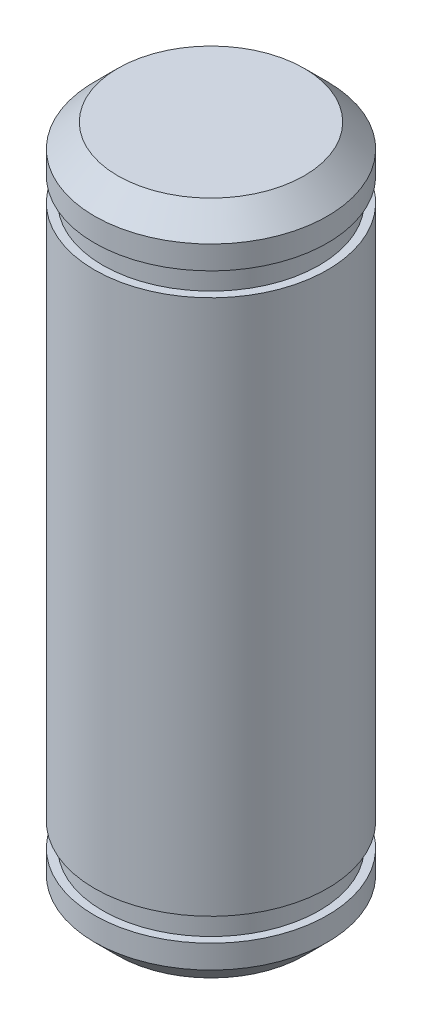
from build123d import *

# Parameters (mm, degrees)
CHAMFER_1_SIZE      = 1
CUT_EXTRUDE_START   = -3
SKETCH_2_R          = 5
SKETCH_2_R_2        = 4.65
CUT_EXTRUDE_1_DEPTH = 1


with BuildPart() as part:
    # 草图1 → 旋转1 (revolve)
    with BuildSketch(Plane.XY, mode=Mode.PRIVATE) as revolve_1_sk:
        Polygon((0, 16), (5, 16), (5, -2), (5, -7), (5, -13), (0, -13), align=None)
    revolve(revolve_1_sk.sketch.rotate(Axis((0, 23.073688006, 0), (0, -1, 0)), 90), axis=Axis((0, 23.073688006, 0), (0, -1, 0)))

    # 倒角1
    chamfer_1_edges = [part.edges().sort_by_distance(p)[0] for p in [
        (0, -13, -5),
        (0, 16, -5),
    ]]
    chamfer(chamfer_1_edges, length=CHAMFER_1_SIZE)

    # 草图2 → 切除-拉伸1 (cut)
    with BuildSketch(Plane(origin=(0, 16, 0), x_dir=(1, 0, 0), z_dir=(0, 1, 0)).offset(CUT_EXTRUDE_START)):
        with Locations(Location((0, 0, 0), (0, 0, 270))):
            Circle(SKETCH_2_R)
        with Locations(Location((0, 0, 0), (0, 0, 270))):
            Circle(SKETCH_2_R_2, mode=Mode.SUBTRACT)
    cut_extrude_1 = extrude(amount=CUT_EXTRUDE_1_DEPTH, mode=Mode.SUBTRACT)

    # 镜向1: 切除-拉伸1 across plane
    add(cut_extrude_1.mirror(Plane.ZX.offset(1.5)), mode=Mode.SUBTRACT)


solid = part.part
